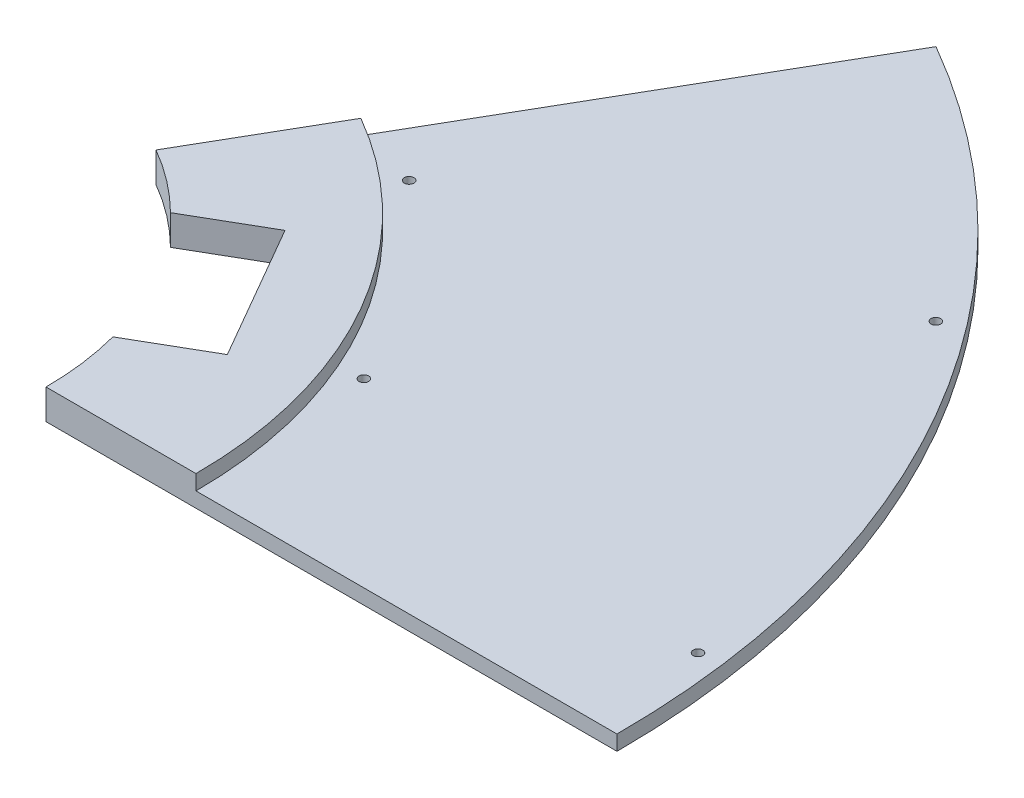
from build123d import *

# Parameters (mm, degrees)
AUFSATZ_LINEAR_AUSTRAGEN1_DEPTH = 5
AUFSATZ_LINEAR_AUSTRAGEN2_DEPTH = 5
SCHNITT_LINEAR_AUSTRAGEN1_DEPTH = 384.76425055
SCHNITT_LINEAR_AUSTRAGEN2_DEPTH = 384.76425055
SKIZZE5_R                       = 1.6
SCHNITT_LINEAR_AUSTRAGEN3_DEPTH = 384.666521865
FASE1_SIZE                      = 2


with BuildPart() as part:
    # Skizze1 → Aufsatz-Linear austragen1 (new body)
    with BuildSketch(Plane(origin=(0, 0, 0), x_dir=(1, 0, 0), z_dir=(0, 1, 0))):
        with BuildLine():
            Line((0, 0), (290, 0))
            ThreePointArc((290, 0), (251.147367097, 145), (145, 251.147367097))
            Line((145, 251.147367097), (0, 0))
        make_face()
    extrude(amount=AUFSATZ_LINEAR_AUSTRAGEN1_DEPTH)

    # Skizze2 → Aufsatz-Linear austragen2 (add)
    with BuildSketch(Plane(origin=(0, 5, 0), x_dir=(1, 0, 0), z_dir=(0, 1, 0))):
        with BuildLine():
            Line((0, 0), (149.9, 0))
            ThreePointArc((149.9, 0), (129.817208027, 74.95), (74.95, 129.817208027))
            Line((74.95, 129.817208027), (0, 0))
        make_face()
    extrude(amount=AUFSATZ_LINEAR_AUSTRAGEN2_DEPTH)

    # Skizze3 → Schnitt-Linear austragen1 (cut, through all)
    with BuildSketch(Plane(origin=(0, 10, 0), x_dir=(1, 0, 0), z_dir=(0, 1, 0))):
        Polygon((26.2, 45.379731158), (94.633560231, 84.889865579), (120.833560231, 39.510134421), (52.4, 0), (0, 0), align=None)
    extrude(amount=-SCHNITT_LINEAR_AUSTRAGEN1_DEPTH, mode=Mode.SUBTRACT)

    # Skizze4 → Schnitt-Linear austragen2 (cut, through all)
    with BuildSketch(Plane(origin=(0, 10, 0), x_dir=(1, 0, 0), z_dir=(0, 1, 0))):
        with BuildLine():
            Line((100, 0), (0, 0))
            Line((0, 0), (50, 86.602540378))
            ThreePointArc((50, 86.602540378), (86.602540378, 50), (100, 0))
        make_face()
    extrude(amount=-SCHNITT_LINEAR_AUSTRAGEN2_DEPTH, mode=Mode.SUBTRACT)

    # Skizze5 → Schnitt-Linear austragen3 (cut, through all)
    with BuildSketch(Plane(origin=(0, 5, 0), x_dir=(1, 0, 0), z_dir=(0, 1, 0))):
        with Locations(Location((95.879925069, 124.953151096, 0), (0, 0, 270))):
            Circle(SKIZZE5_R)
        with Locations(Location((224.122318632, 171.975103695, 0), (0, 0, 270))):
            Circle(SKIZZE5_R)
        with Locations(Location((145.511026371, 60.272640598, 0), (0, 0, 270))):
            Circle(SKIZZE5_R)
        with Locations(Location((280.083173338, 36.873649302, 0), (0, 0, 270))):
            Circle(SKIZZE5_R)
    extrude(amount=-SCHNITT_LINEAR_AUSTRAGEN3_DEPTH, mode=Mode.SUBTRACT)

    # Fase1
    fase1_edges = [part.edges().sort_by_distance(p)[0] for p in [
        (95.879925069, 0, -126.553151096),
        (224.122318632, 0, -173.575103695),
        (145.511026371, 0, -61.872640598),
        (280.083173338, 0, -38.473649302),
    ]]
    chamfer(fase1_edges, length=FASE1_SIZE)


solid = part.part
